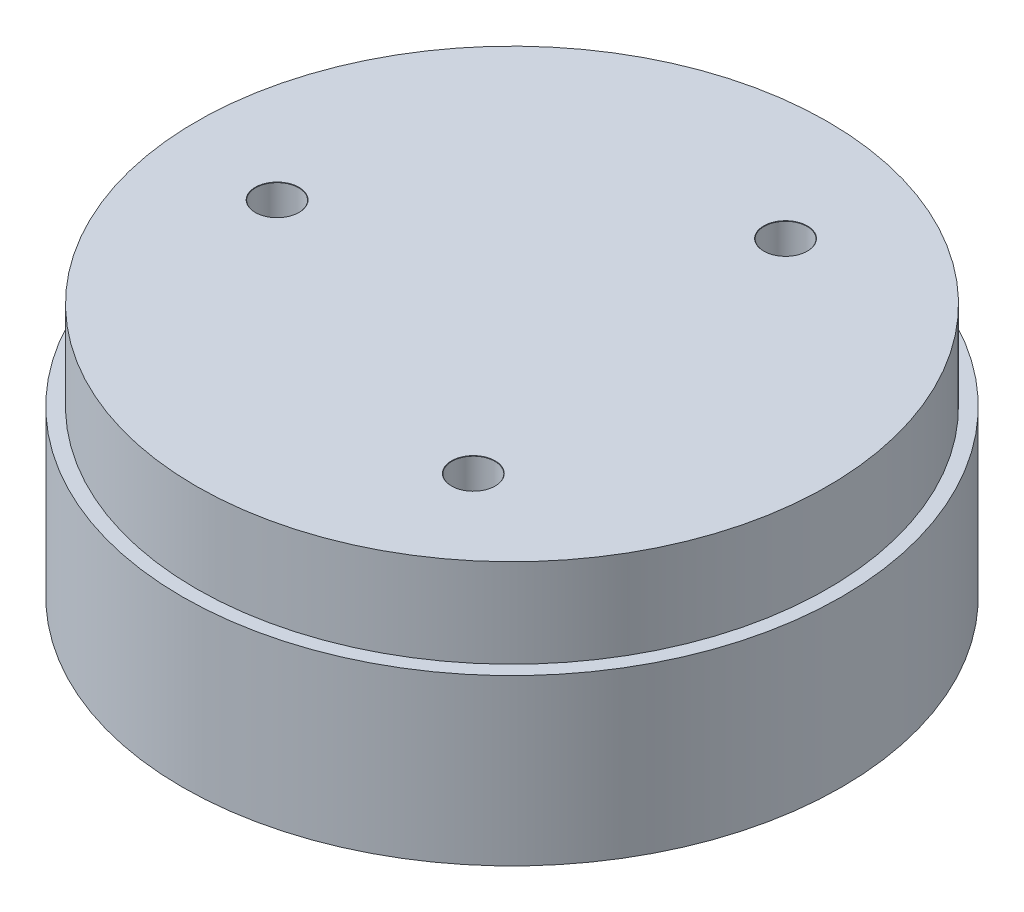
from build123d import *

# Parameters (mm, degrees)
SKETCH5_R                      = 26
BOSS_EXTRUDE3_DEPTH            = 13
SKETCH6_R                      = 24.9
BOSS_EXTRUDE4_DEPTH            = 7
M3_CLEARANCE_HOLE1_D           = 3.4
M3_CLEARANCE_HOLE1_CSINK_D     = 3.45
M3_CLEARANCE_HOLE1_CSINK_ANGLE = 90


with BuildPart() as part:
    # Sketch5 → Boss-Extrude3 (new body)
    with BuildSketch(Plane(origin=(0, 0, 0), x_dir=(-1, 0, 0), z_dir=(0, 1, 0))):
        with Locations(Location((0, 0, 0), (0, 0, 270))):
            Circle(SKETCH5_R)
    extrude(amount=BOSS_EXTRUDE3_DEPTH)

    # Sketch6 → Boss-Extrude4 (add)
    with BuildSketch(Plane(origin=(0, 13, 0), x_dir=(-1, 0, 0), z_dir=(0, 1, 0))):
        with Locations(Location((0, 0, 0), (0, 0, 90))):
            Circle(SKETCH6_R)
    extrude(amount=BOSS_EXTRUDE4_DEPTH)

    # M3 Clearance Hole1 (through all)
    with Locations(Plane(origin=(0, 20, 0), x_dir=(-1, 0, 0), z_dir=(0, 1, 0))):
        with Locations((-6.318103468, -15.253251082), (-10.050651193, 13.098263648), (16.368754661, 2.154987434)):
            CounterSinkHole(M3_CLEARANCE_HOLE1_D / 2, M3_CLEARANCE_HOLE1_CSINK_D / 2, counter_sink_angle=M3_CLEARANCE_HOLE1_CSINK_ANGLE)


solid = part.part
